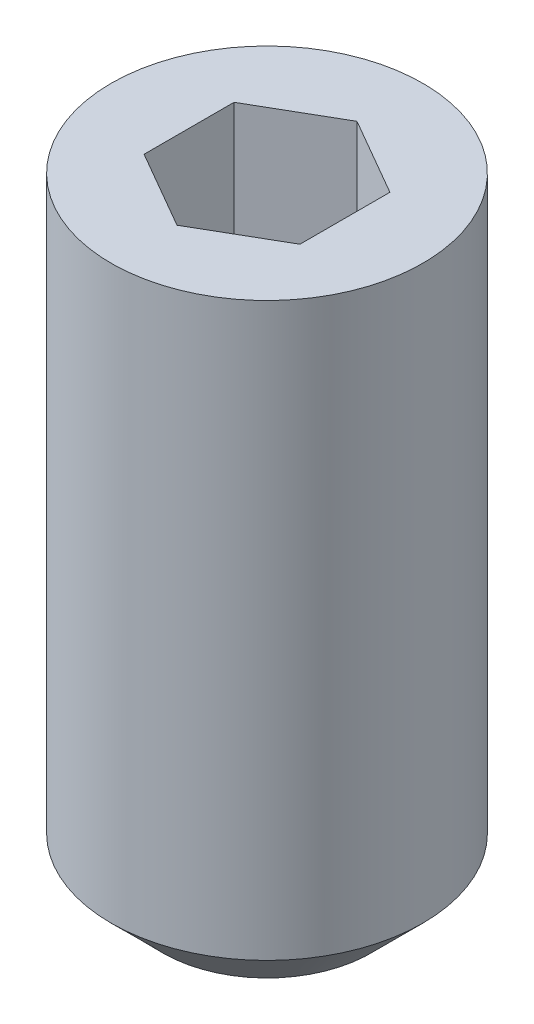
from build123d import *

# Parameters (mm, degrees)
SKETCH1_W          = 1.5
SKETCH1_H          = 6
CUT_EXTRUDE1_DEPTH = 1.2


with BuildPart() as part:
    # Sketch1 → Revolve1 (revolve)
    with BuildSketch(Plane.XY, mode=Mode.PRIVATE) as revolve1_sk:
        with Locations((0.75, 3)):
            Rectangle(SKETCH1_W, SKETCH1_H)
    revolve(revolve1_sk.sketch.rotate(Axis((0, 6, 0), (0, -1, 0)), 180), axis=Axis((0, 6, 0), (0, -1, 0)))

    # Sketch2 → Cut-Revolve1 (revolve, cut)
    with BuildSketch(Plane.XY, mode=Mode.PRIVATE) as cut_revolve1_sk:
        Polygon((0, 6), (0.75, 6), (0.75, 4.8), (0, 4.366987298), align=None)
    revolve(cut_revolve1_sk.sketch.rotate(Axis((0, 6, 0), (0, -1, 0)), 180), axis=Axis((0, 6, 0), (0, -1, 0)), mode=Mode.SUBTRACT)

    # Sketch3 → Cut-Extrude1 (cut)
    with BuildSketch(Plane(origin=(0, 6, 0), x_dir=(1, 0, 0), z_dir=(0, 1, 0))):
        Polygon((0, 0.866025404), (-0.75, 0.433012702), (-0.75, -0.433012702), (0, -0.866025404), (0.75, -0.433012702), (0.75, 0.433012702), align=None)
    extrude(amount=-CUT_EXTRUDE1_DEPTH, mode=Mode.SUBTRACT)

    # Sketch4 → Cut-Revolve2 (revolve, cut)
    with BuildSketch(Plane.XY, mode=Mode.PRIVATE) as cut_revolve2_sk:
        Polygon((1, 0), (1.5, 0), (1.5, 0.5), align=None)
    revolve(cut_revolve2_sk.sketch.rotate(Axis((0, 0, 0), (0, 1, 0)), 180), axis=Axis((0, 0, 0), (0, 1, 0)), mode=Mode.SUBTRACT)


solid = part.part
